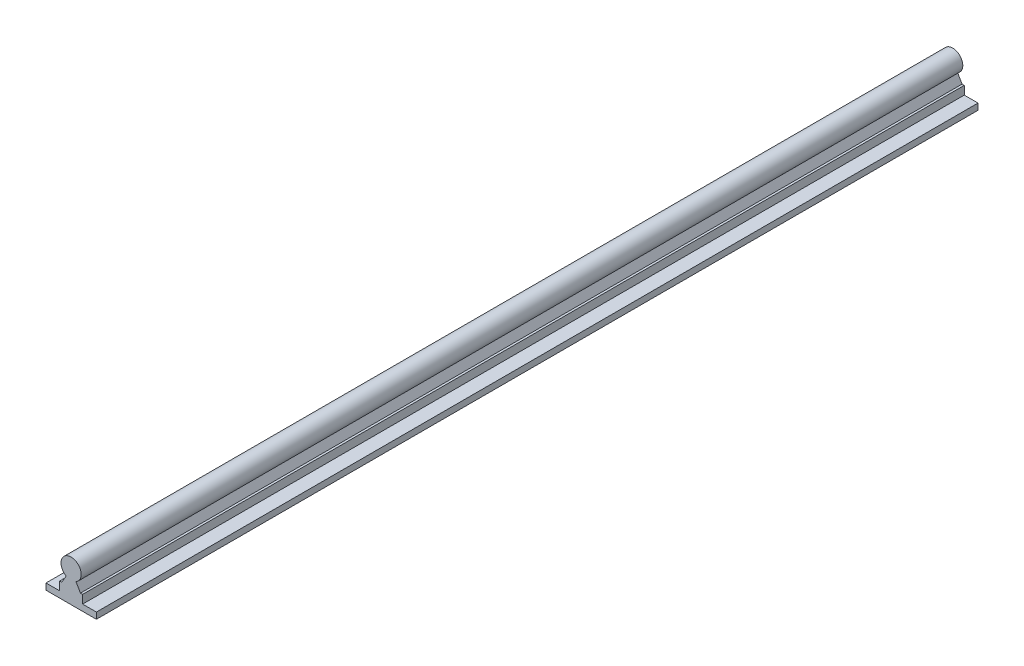
from build123d import *

# Parameters (mm, degrees)
BOSS_EXTRU_1_DEPTH = 700


with BuildPart() as part:
    # Esquisse1 → Boss.-Extru.1 (new body)
    with BuildSketch(Plane.XY):
        with BuildLine():
            Line((-25.931265673, -2.76101993), (-15.181265673, -2.76101993))
            Line((-15.181265673, -2.76101993), (-15.181265673, 3.93898007))
            Line((-15.181265673, 3.93898007), (-13.453102315, 3.93898007))
            Line((-13.453102315, 3.93898007), (-9.931265673, 10.03898007))
            ThreePointArc((-9.931265673, 10.03898007), (-6.010431334, 25.012290482), (-2.089596996, 10.03898007))
            Line((-2.089596996, 10.03898007), (1.432239646, 3.93898007))
            Line((1.432239646, 3.93898007), (3.160403004, 3.93898007))
            Line((3.160403004, 3.93898007), (3.160403004, -2.76101993))
            Line((3.160403004, -2.76101993), (14.068734327, -2.76101993))
            Line((14.068734327, -2.76101993), (14.068734327, -7.76101993))
            Line((14.068734327, -7.76101993), (-25.931265673, -7.76101993))
            Line((-25.931265673, -7.76101993), (-25.931265673, -2.76101993))
        make_face()
    extrude(amount=BOSS_EXTRU_1_DEPTH)


solid = part.part
